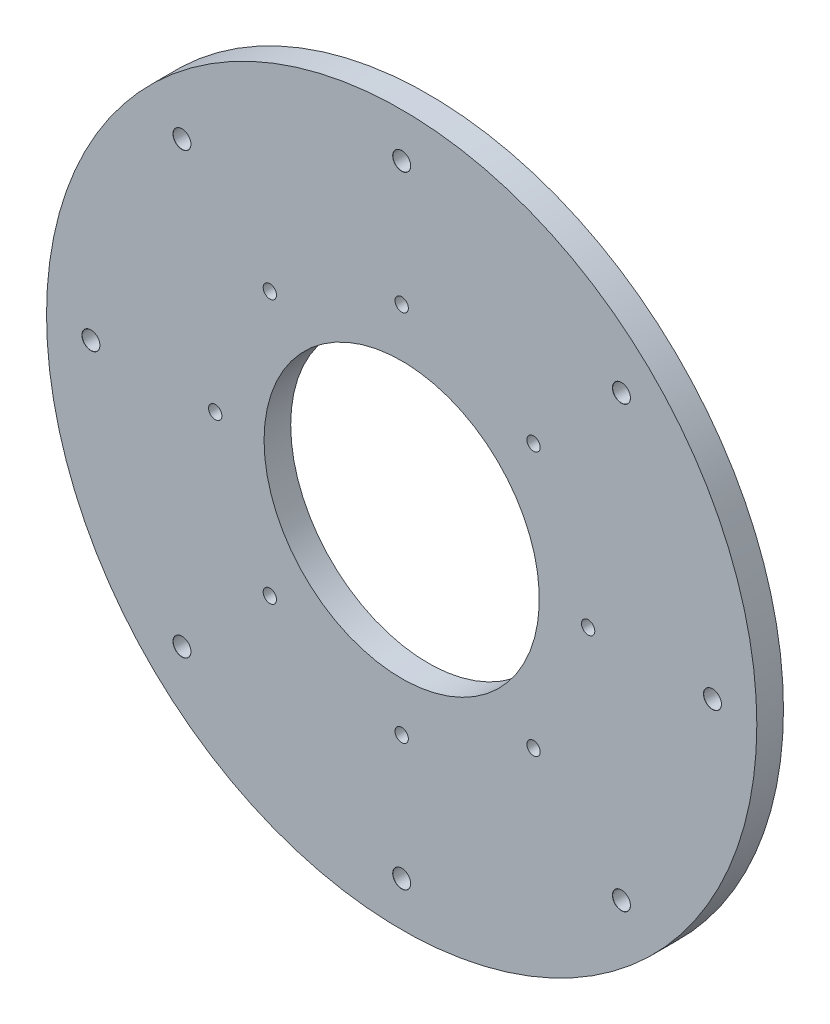
from build123d import *

# Parameters (mm, degrees)
SKETCH2_R                       = 80
SKETCH2_R_2                     = 31
BOSS_EXTRUDE1_DEPTH             = 6
F_4_0MM_DOWEL_HOLE1_D           = 4
F_4_0MM_DOWEL_HOLE1_CSINK_D     = 4.05
F_4_0MM_DOWEL_HOLE1_CSINK_ANGLE = 90
F_3_0MM_DOWEL_HOLE1_D           = 3
F_3_0MM_DOWEL_HOLE1_DEPTH       = 6
F_3_0MM_DOWEL_HOLE1_CSINK_D     = 3.05
F_3_0MM_DOWEL_HOLE1_CSINK_ANGLE = 90
F_3_0MM_DOWEL_HOLE1_TIP         = 0.901290929


with BuildPart() as part:
    # Sketch2 → Boss-Extrude1 (new body)
    with BuildSketch(Plane.XY):
        Circle(SKETCH2_R)
        Circle(SKETCH2_R_2, mode=Mode.SUBTRACT)
    extrude(amount=BOSS_EXTRUDE1_DEPTH)

    # Ø4.0mm Dowel Hole1 (through all)
    with Locations(Plane.XY.offset(6)):
        with Locations((0, 70), (-49.497474683, 49.497474683), (-70, 0), (-49.497474683, -49.497474683), (0, -70), (49.497474683, -49.497474683), (70, 0), (49.497474683, 49.497474683)):
            CounterSinkHole(F_4_0MM_DOWEL_HOLE1_D / 2, F_4_0MM_DOWEL_HOLE1_CSINK_D / 2, counter_sink_angle=F_4_0MM_DOWEL_HOLE1_CSINK_ANGLE)

    # Ø3.0mm Dowel Hole1
    with Locations(Plane(origin=(0, 0, 0), x_dir=(-1, 0, 0), z_dir=(0, 0, -1))):
        with Locations((-29.69848481, -29.69848481), (-42, 0), (-29.69848481, 29.69848481), (0, 42), (29.69848481, 29.69848481), (42, 0), (29.69848481, -29.69848481), (0, -42)):
            CounterSinkHole(F_3_0MM_DOWEL_HOLE1_D / 2, F_3_0MM_DOWEL_HOLE1_CSINK_D / 2, depth=F_3_0MM_DOWEL_HOLE1_DEPTH, counter_sink_angle=F_3_0MM_DOWEL_HOLE1_CSINK_ANGLE)
            with Locations((0, 0, -(F_3_0MM_DOWEL_HOLE1_DEPTH + F_3_0MM_DOWEL_HOLE1_TIP / 2))):  # 118° drill point
                Cone(0, F_3_0MM_DOWEL_HOLE1_D / 2, F_3_0MM_DOWEL_HOLE1_TIP, mode=Mode.SUBTRACT)


solid = part.part
